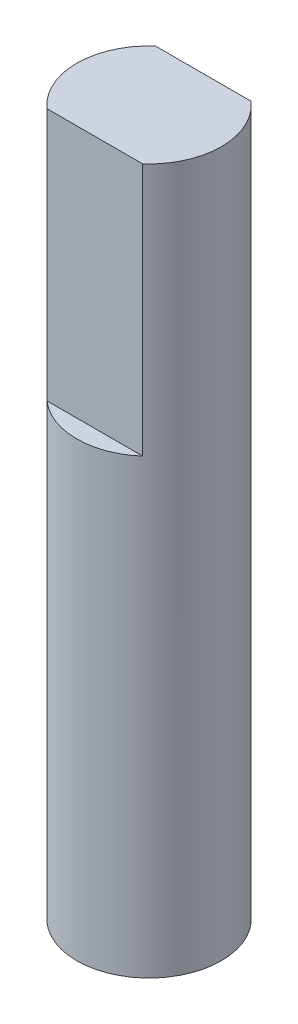
from build123d import *

# Parameters (mm, degrees)
CROQUIS1_R              = 4
SALIENTE_EXTRUIR1_DEPTH = 25
SALIENTE_EXTRUIR2_DEPTH = 14


with BuildPart() as part:
    # Croquis1 → Saliente-Extruir1 (new body)
    with BuildSketch(Plane(origin=(0, 0, 0), x_dir=(1, 0, 0), z_dir=(0, 1, 0))):
        with Locations(Location((0, 0, 0), (0, 0, 270))):
            Circle(CROQUIS1_R)
    extrude(amount=SALIENTE_EXTRUIR1_DEPTH)

    # Croquis2 → Saliente-Extruir2 (add)
    with BuildSketch(Plane(origin=(0, 25, 0), x_dir=(1, 0, 0), z_dir=(0, 1, 0))):
        with BuildLine():
            Line((-2.645751311, -3), (2.645751311, -3))
            ThreePointArc((2.645751311, -3), (4, 0), (2.645751311, 3))
            Line((2.645751311, 3), (-2.645751311, 3))
            ThreePointArc((-2.645751311, 3), (-4, 0), (-2.645751311, -3))
        make_face()
    extrude(amount=SALIENTE_EXTRUIR2_DEPTH)


solid = part.part
